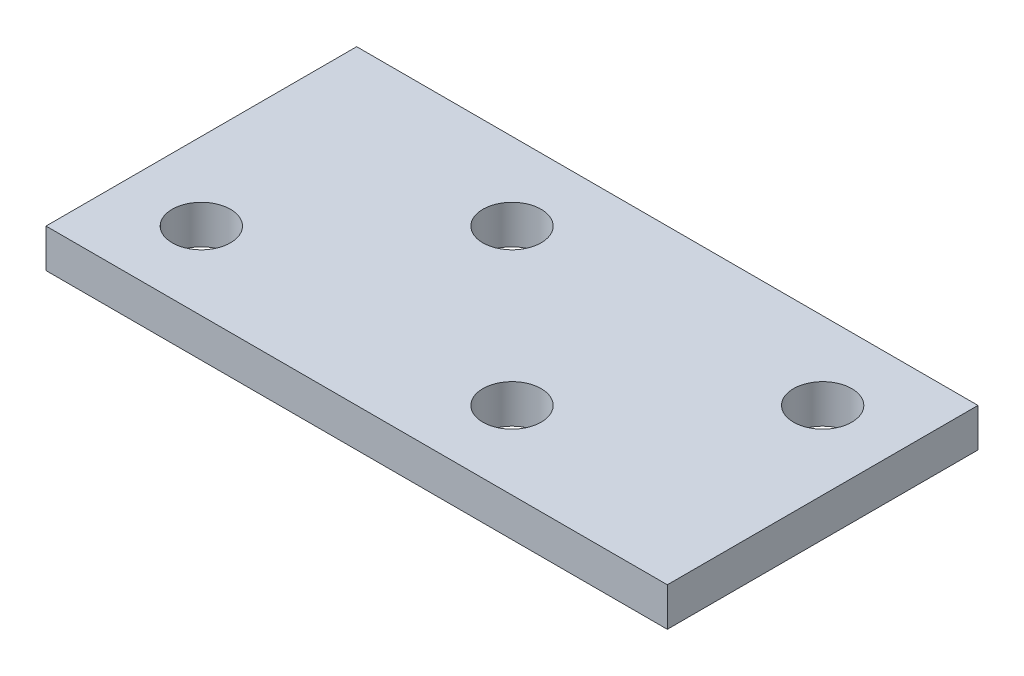
from build123d import *

# Parameters (mm, degrees)
CROQUIS1_W              = 101.6
CROQUIS1_H              = 50.8
SALIENTE_EXTRUIR1_DEPTH = 6.31
CROQUIS2_R              = 4.7625
CORTAR_EXTRUIR1_DEPTH   = 6.31
MATRIZL1_COUNT          = 2
MATRIZL1_PITCH          = 50.8


with BuildPart() as part:
    # Croquis1 → Saliente-Extruir1 (new body)
    with BuildSketch(Plane(origin=(0, 0, 0), x_dir=(1, 0, 0), z_dir=(0, 1, 0))):
        Rectangle(CROQUIS1_W, CROQUIS1_H)
    extrude(amount=SALIENTE_EXTRUIR1_DEPTH)

    # Croquis2 → Cortar-Extruir1 (cut)
    with BuildSketch(Plane(origin=(0, 6.31, 0), x_dir=(1, 0, 0), z_dir=(0, 1, 0))):
        with Locations(Location((-38.1, -12.7, 0), (0, 0, 270))):
            Circle(CROQUIS2_R)
        with Locations(Location((-12.7, 12.7, 0), (0, 0, 270))):
            Circle(CROQUIS2_R)
    cortar_extruir1 = extrude(amount=-CORTAR_EXTRUIR1_DEPTH, mode=Mode.SUBTRACT)

    # MatrizL1: Cortar-Extruir1 ×2
    with Locations(*[(i * MATRIZL1_PITCH, 0, 0) for i in range(1, MATRIZL1_COUNT)]):
        add(cortar_extruir1, mode=Mode.SUBTRACT)


solid = part.part
